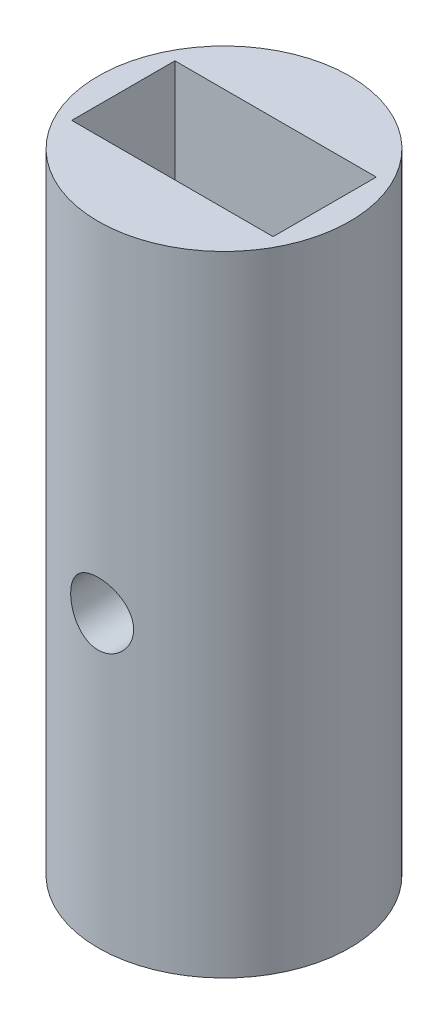
from build123d import *

# Parameters (mm, degrees)
SKETCH1_R               = 5
BOSS_EXTRUDE1_DEPTH     = 25
CUT_EXTRUDE1_DEPTH      = 2.05
CUT_EXTRUDE2_DEPTH      = 27.451890292
CUT_EXTRUDE2_DEPTH_BACK = 27.451890292
SKETCH3_R               = 1.25


with BuildPart() as part:
    # Sketch1 → Boss-Extrude1 (new body)
    with BuildSketch(Plane(origin=(0, 0, 0), x_dir=(1, 0, 0), z_dir=(0, 1, 0))):
        with Locations(Location((0, 0, 0), (0, 0, 270))):
            Circle(SKETCH1_R)
    extrude(amount=BOSS_EXTRUDE1_DEPTH)

    # Sketch2 → Cut-Extrude1 (cut, symmetric)
    with BuildSketch(Plane.XY):
        with BuildLine():
            Line((-4, 11.5), (-4, 25))
            Line((-4, 25), (4, 25))
            Line((4, 25), (4, 11.5))
            ThreePointArc((4, 11.5), (0, 7.5), (-4, 11.5))
        make_face()
    extrude(amount=CUT_EXTRUDE1_DEPTH, both=True, mode=Mode.SUBTRACT)

    # Sketch3 → Cut-Extrude2 (cut, two sides: drawn at the far end of the back side and taken through both)
    with BuildSketch(Plane.XY.offset(2.05).offset(-CUT_EXTRUDE2_DEPTH_BACK)):
        with Locations((0, 11.5)):
            Circle(SKETCH3_R)
    extrude(amount=CUT_EXTRUDE2_DEPTH + CUT_EXTRUDE2_DEPTH_BACK, mode=Mode.SUBTRACT)


solid = part.part
